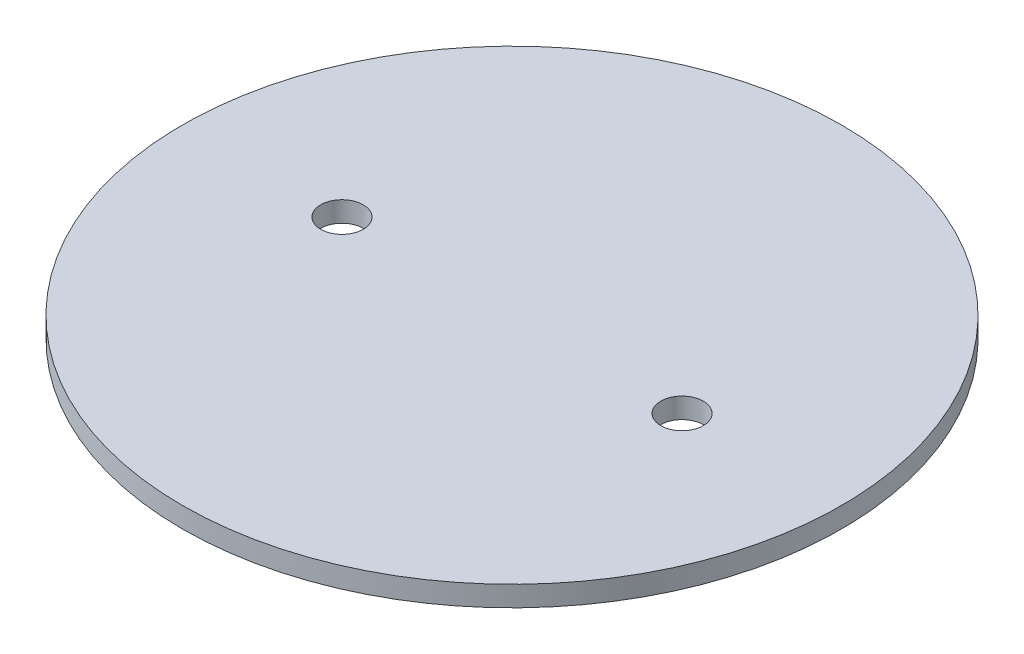
from build123d import *

# Parameters (mm, degrees)
SKETCH1_R           = 96.9
SKETCH1_R_2         = 6.25
BOSS_EXTRUDE1_DEPTH = 3


with BuildPart() as part:
    # Sketch1 → Boss-Extrude1 (new, symmetric)
    with BuildSketch(Plane(origin=(0, 0, 0), x_dir=(1, 0, 0), z_dir=(0, 1, 0))):
        with Locations(Location((0, 0, 0), (0, 0, 270))):
            Circle(SKETCH1_R)
        with Locations(Location((-50, 0, 0), (0, 0, 270))):
            Circle(SKETCH1_R_2, mode=Mode.SUBTRACT)
        with Locations(Location((50, 0, 0), (0, 0, 270))):
            Circle(SKETCH1_R_2, mode=Mode.SUBTRACT)
    extrude(amount=BOSS_EXTRUDE1_DEPTH, both=True)


solid = part.part
